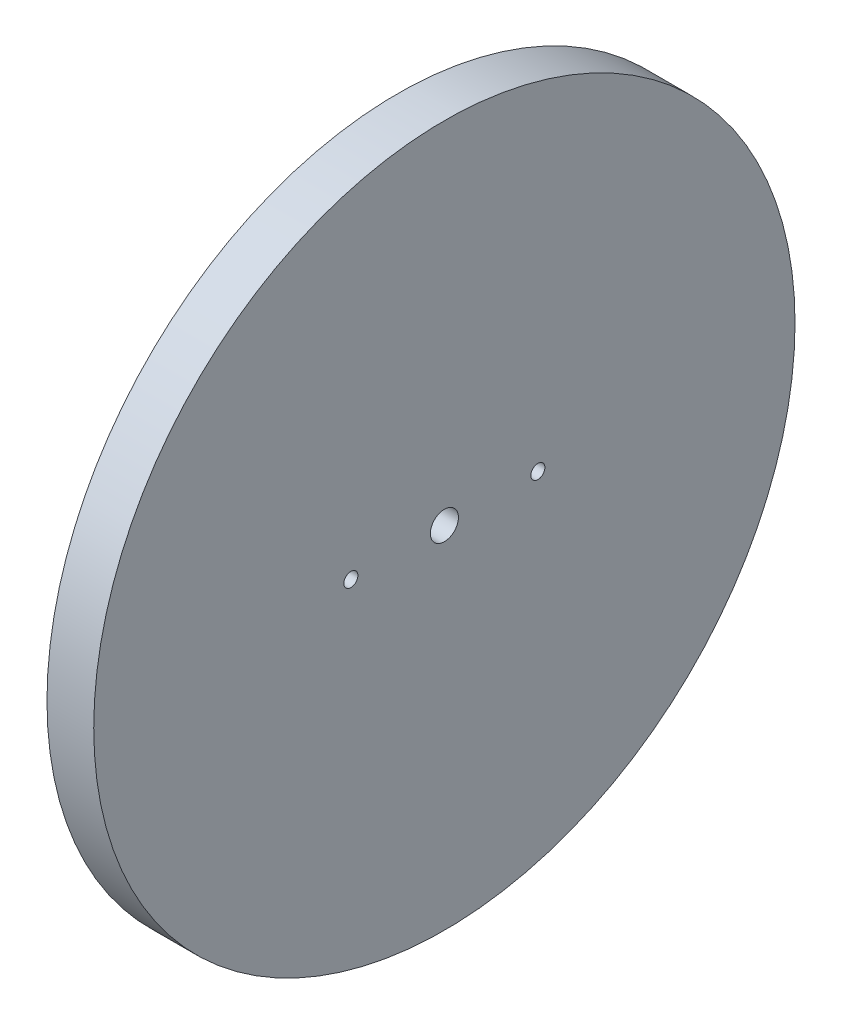
from build123d import *

# Parameters (mm, degrees)
SKETCH_1_R          = 75
EXTRUDE_1_DEPTH     = 10
SKETCH_2_R          = 3
SKETCH_2_R_2        = 1.5
CUT_EXTRUDE_1_DEPTH = 10
SKETCH_3_R          = 6
CUT_EXTRUDE_2_DEPTH = 3
SKETCH_4_R          = 3
CUT_EXTRUDE_3_DEPTH = 3
SKETCH_5_R          = 3
CUT_EXTRUDE_4_DEPTH = 3


with BuildPart() as part:
    # 草图1 → 凸台-拉伸1 (new body)
    with BuildSketch(Plane(origin=(0, 0, 0), x_dir=(0, 0, -1), z_dir=(1, 0, 0))):
        Circle(SKETCH_1_R)
    extrude(amount=EXTRUDE_1_DEPTH)

    # 草图2 → 切除-拉伸1 (cut)
    with BuildSketch(Plane(origin=(10, 0, 0), x_dir=(0, 0, -1), z_dir=(1, 0, 0))):
        Circle(SKETCH_2_R)
        with Locations((-20, 0)):
            Circle(SKETCH_2_R_2)
        with Locations((20, 0)):
            Circle(SKETCH_2_R_2)
    extrude(amount=-CUT_EXTRUDE_1_DEPTH, mode=Mode.SUBTRACT)

    # 草图3 → 切除-拉伸2 (cut)
    with BuildSketch(Plane.ZY):
        Circle(SKETCH_3_R)
    extrude(amount=-CUT_EXTRUDE_2_DEPTH, mode=Mode.SUBTRACT)

    # 草图4 → 切除-拉伸3 (cut)
    with BuildSketch(Plane.ZY):
        with Locations((20, 0)):
            Circle(SKETCH_4_R)
    extrude(amount=-CUT_EXTRUDE_3_DEPTH, mode=Mode.SUBTRACT)

    # 草图5 → 切除-拉伸4 (cut)
    with BuildSketch(Plane.ZY):
        with Locations((-20, 0)):
            Circle(SKETCH_5_R)
    extrude(amount=-CUT_EXTRUDE_4_DEPTH, mode=Mode.SUBTRACT)


solid = part.part
